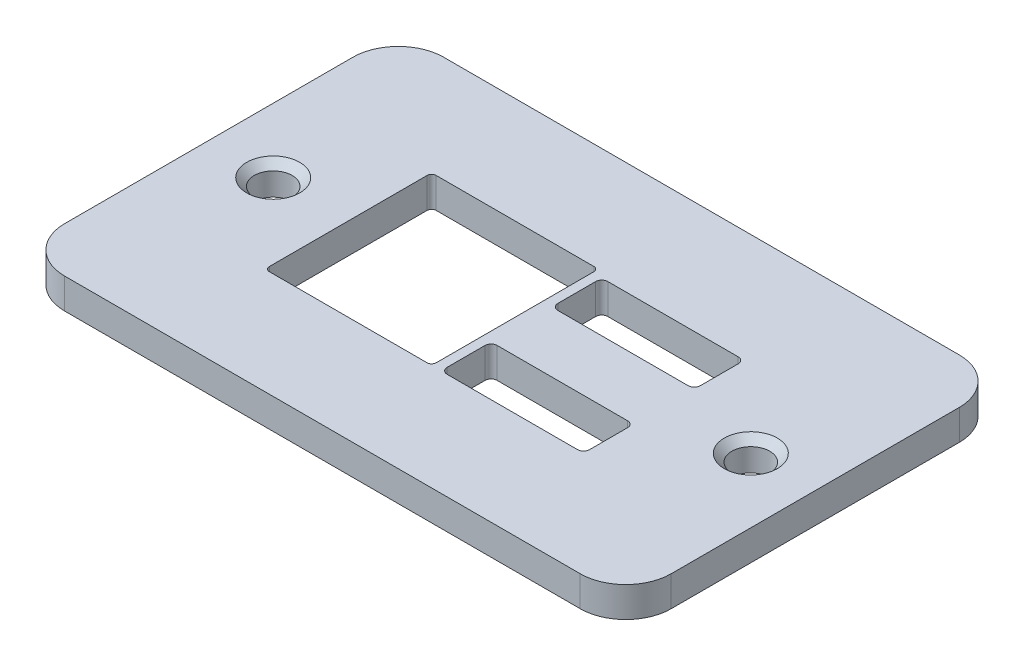
from build123d import *

# Parameters (mm, degrees)
EXTRUDE_1_DEPTH            = 2
CUT_EXTRUDE_1_REACH        = 25.67
SKETCH_2_R                 = 1.25
CHAMFER_1_SIZE             = 0.5
CHAMFER_1_OF_MIRROR_3_SIZE = 0.5
CUT_EXTRUDE_2_REACH        = 25.67
CUT_EXTRUDE_3_REACH        = 25.67
CUT_EXTRUDE_4_REACH        = 25.67


with BuildPart() as part:
    # 草图1 → 凸台-拉伸1 (new body)
    with BuildSketch(Plane(origin=(0, 0, 0), x_dir=(1, 0, 0), z_dir=(0, 1, 0))):
        with BuildLine():
            Line((-17, 12.5), (17, 12.5))
            ThreePointArc((17, 12.5), (19.121320344, 11.621320344), (20, 9.5))
            Line((20, 9.5), (20, -9.5))
            ThreePointArc((20, -9.5), (19.121320344, -11.621320344), (17, -12.5))
            Line((17, -12.5), (-17, -12.5))
            ThreePointArc((-17, -12.5), (-19.121320344, -11.621320344), (-20, -9.5))
            Line((-20, -9.5), (-20, 9.5))
            ThreePointArc((-20, 9.5), (-19.121320344, 11.621320344), (-17, 12.5))
        make_face()
    extrude(amount=EXTRUDE_1_DEPTH)

    # 草图2 → 切除-拉伸1 (cut, up to next)
    with BuildSketch(Plane(origin=(0, 2, 0), x_dir=(1, 0, 0), z_dir=(0, 1, 0)), mode=Mode.PRIVATE) as cut_extrude_1_sk1:
        with Locations(Location((-15.75, 0, 0), (0, 0, 270))):
            Circle(SKETCH_2_R)
    cut_extrude_1_tool1 = extrude(cut_extrude_1_sk1.sketch, amount=-CUT_EXTRUDE_1_REACH, mode=Mode.PRIVATE) & part.part
    cut_extrude_1 = cut_extrude_1_tool1.solids().sort_by_distance((-15.75, 2, 0))[0]
    add(cut_extrude_1, mode=Mode.SUBTRACT)

    # 倒角1
    chamfer_1_edges = [part.edges().sort_by_distance(p)[0] for p in [
        (-15.75, 2, -1.25),
    ]]
    chamfer(chamfer_1_edges, length=CHAMFER_1_SIZE)

    # 镜向3: 切除-拉伸1 across plane
    add(cut_extrude_1.mirror(Plane(origin=(0, 0, 0), x_dir=(0, 0, 1), z_dir=(1, 0, 0))), mode=Mode.SUBTRACT)

    # 倒角1 of 镜向3
    chamfer_1_of_mirror_3_edges = [part.edges().sort_by_distance(p)[0] for p in [
        (15.75, 2, -1.25),
    ]]
    chamfer(chamfer_1_of_mirror_3_edges, length=CHAMFER_1_OF_MIRROR_3_SIZE)

    # 草图3 → 切除-拉伸2 (cut, up to next)
    with BuildSketch(Plane(origin=(0, 2, 0), x_dir=(1, 0, 0), z_dir=(0, 1, 0)), mode=Mode.PRIVATE) as cut_extrude_2_sk1:
        with BuildLine():
            Line((-10.5, 5.5), (-0.1, 5.5))
            ThreePointArc((-0.1, 5.5), (0.112132034, 5.412132034), (0.2, 5.2))
            Line((0.2, 5.2), (0.2, -5.2))
            ThreePointArc((0.2, -5.2), (0.112132034, -5.412132034), (-0.1, -5.5))
            Line((-0.1, -5.5), (-10.5, -5.5))
            ThreePointArc((-10.5, -5.5), (-10.712132034, -5.412132034), (-10.8, -5.2))
            Line((-10.8, -5.2), (-10.8, 5.2))
            ThreePointArc((-10.8, 5.2), (-10.712132034, 5.412132034), (-10.5, 5.5))
        make_face()
    cut_extrude_2_tool1 = extrude(cut_extrude_2_sk1.sketch, amount=-CUT_EXTRUDE_2_REACH, mode=Mode.PRIVATE) & part.part
    add(cut_extrude_2_tool1.solids().sort_by_distance((-5.3, 2, 0))[0], mode=Mode.SUBTRACT)

    # 草图4 → 切除-拉伸3 (cut, up to next)
    with BuildSketch(Plane(origin=(0, 2, 0), x_dir=(1, 0, 0), z_dir=(0, 1, 0)), mode=Mode.PRIVATE) as cut_extrude_3_sk1:
        with BuildLine():
            Line((1.22, -2.2), (9.82, -2.2))
            ThreePointArc((9.82, -2.2), (10.102842712, -2.317157288), (10.22, -2.6))
            Line((10.22, -2.6), (10.22, -5.1))
            ThreePointArc((10.22, -5.1), (10.102842712, -5.382842712), (9.82, -5.5))
            Line((9.82, -5.5), (1.22, -5.5))
            ThreePointArc((1.22, -5.5), (0.937157288, -5.382842712), (0.82, -5.1))
            Line((0.82, -5.1), (0.82, -2.6))
            ThreePointArc((0.82, -2.6), (0.937157288, -2.317157288), (1.22, -2.2))
        make_face()
    cut_extrude_3_tool1 = extrude(cut_extrude_3_sk1.sketch, amount=-CUT_EXTRUDE_3_REACH, mode=Mode.PRIVATE) & part.part
    add(cut_extrude_3_tool1.solids().sort_by_distance((5.52, 2, 3.85))[0], mode=Mode.SUBTRACT)

    # 草图5 → 切除-拉伸4 (cut, up to next)
    with BuildSketch(Plane(origin=(0, 2, 0), x_dir=(1, 0, 0), z_dir=(0, 1, 0)), mode=Mode.PRIVATE) as cut_extrude_4_sk1:
        with BuildLine():
            Line((1.22, 5.1), (9.82, 5.1))
            ThreePointArc((9.82, 5.1), (10.102842712, 4.982842712), (10.22, 4.7))
            Line((10.22, 4.7), (10.22, 2.2))
            ThreePointArc((10.22, 2.2), (10.102842712, 1.917157288), (9.82, 1.8))
            Line((9.82, 1.8), (1.22, 1.8))
            ThreePointArc((1.22, 1.8), (0.937157288, 1.917157288), (0.82, 2.2))
            Line((0.82, 2.2), (0.82, 4.7))
            ThreePointArc((0.82, 4.7), (0.937157288, 4.982842712), (1.22, 5.1))
        make_face()
    cut_extrude_4_tool1 = extrude(cut_extrude_4_sk1.sketch, amount=-CUT_EXTRUDE_4_REACH, mode=Mode.PRIVATE) & part.part
    add(cut_extrude_4_tool1.solids().sort_by_distance((5.52, 2, -3.45))[0], mode=Mode.SUBTRACT)


solid = part.part
